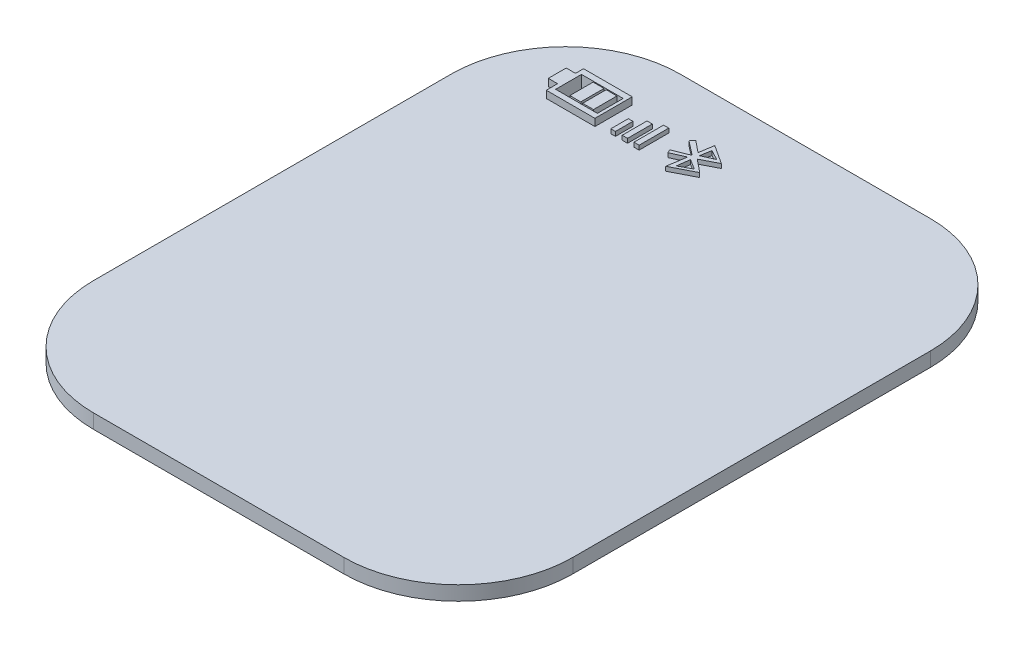
from build123d import *

# Parameters (mm, degrees)
BOSS_EXTRUDE1_DEPTH = 1
SKETCH2_W           = 3.399574798
SKETCH2_H           = 2.604207363
SKETCH2_W_2         = 0.648007004
SKETCH2_H_2         = 1.252018983
BOSS_EXTRUDE2_DEPTH = 0.5
SKETCH3_W           = 2.913906285
SKETCH3_H           = 1.803051724
CUT_EXTRUDE1_DEPTH  = 1
SKETCH4_W           = 0.755256807
SKETCH4_H           = 1.639917717
SKETCH4_W_2         = 0.763724631
SKETCH4_H_2         = 1.626197377
BOSS_EXTRUDE3_DEPTH = 1
SKETCH6_W           = 0.323055787
SKETCH6_H           = 1.224923668
SKETCH6_W_2         = 0.371772392
SKETCH6_H_2         = 1.735099538
SKETCH6_W_3         = 0.361493721
SKETCH6_H_3         = 2.070814397
BOSS_EXTRUDE4_DEPTH = 0.3
BOSS_EXTRUDE8_DEPTH = 0.3


with BuildPart() as part:
    # Sketch1 → Boss-Extrude1 (new body)
    with BuildSketch(Plane(origin=(0, 0, 0), x_dir=(1, 0, 0), z_dir=(0, 1, 0))):
        with BuildLine():
            Line((-8.75, 20.5), (8.75, 20.5))
            ThreePointArc((8.75, 20.5), (14.406854249, 18.156854249), (16.75, 12.5))
            Line((16.75, 12.5), (16.75, -12.5))
            ThreePointArc((16.75, -12.5), (14.406854249, -18.156854249), (8.75, -20.5))
            Line((8.75, -20.5), (-8.75, -20.5))
            ThreePointArc((-8.75, -20.5), (-14.406854249, -18.156854249), (-16.75, -12.5))
            Line((-16.75, -12.5), (-16.75, 12.5))
            ThreePointArc((-16.75, 12.5), (-14.406854249, 18.156854249), (-8.75, 20.5))
        make_face()
    extrude(amount=BOSS_EXTRUDE1_DEPTH)

    # Sketch2 → Boss-Extrude2 (add)
    with BuildSketch(Plane(origin=(0, 1, 0), x_dir=(1, 0, 0), z_dir=(0, 1, 0))):
        with Locations((-10.250837729, 15.647459094)):
            Rectangle(SKETCH2_W, SKETCH2_H)
        with Locations((-12.27462863, 15.762007905)):
            Rectangle(SKETCH2_W_2, SKETCH2_H_2)
    extrude(amount=BOSS_EXTRUDE2_DEPTH)

    # Sketch3 → Cut-Extrude1 (cut)
    with BuildSketch(Plane(origin=(0, 1.5, 0), x_dir=(1, 0, 0), z_dir=(0, 1, 0))):
        with Locations((-10.221842574, 15.632123632)):
            Rectangle(SKETCH3_W, SKETCH3_H)
    extrude(amount=-CUT_EXTRUDE1_DEPTH, mode=Mode.SUBTRACT)

    # Sketch4 → Boss-Extrude3 (add)
    with BuildSketch(Plane(origin=(0, 0.5, 0), x_dir=(1, 0, 0), z_dir=(0, 1, 0))):
        with Locations((-9.510068413, 15.646512941)):
            Rectangle(SKETCH4_W, SKETCH4_H)
        with Locations((-10.421480669, 15.658650775)):
            Rectangle(SKETCH4_W_2, SKETCH4_H_2)
    extrude(amount=BOSS_EXTRUDE3_DEPTH)

    # Sketch6 → Boss-Extrude4 (add)
    with BuildSketch(Plane(origin=(0, 1, 0), x_dir=(1, 0, 0), z_dir=(0, 1, 0))):
        with Locations((-7.401507334, 15.079514795)):
            Rectangle(SKETCH6_W, SKETCH6_H)
        with Locations((-6.585633976, 15.340608205)):
            Rectangle(SKETCH6_W_2, SKETCH6_H_2)
        with Locations((-5.759844772, 15.498462338)):
            Rectangle(SKETCH6_W_3, SKETCH6_H_3)
    extrude(amount=BOSS_EXTRUDE4_DEPTH)

    # Sketch7 → Boss-Extrude8 (add)
    with BuildSketch(Plane(origin=(0, 1, 0), x_dir=(1, 0, 0), z_dir=(0, 1, 0))):
        Polygon((-2.913348429, 17.083305865), (-3.070822573, 16.069437014), (-3.890044364, 16.734757778), (-4.10463288, 16.470530961), (-3.125803438, 15.71545264), (-3.128811108, 15.696088298), (-4.220670364, 15.251854963), (-4.125911477, 15.018951756), (-3.168901436, 15.437973959), (-3.374102624, 14.116823145), (-1.801517614, 14.921145153), (-2.70763201, 15.653067043), (-1.594376902, 16.222457937), align=None)
        Polygon((-2.913348429, 15.389877589), (-3.025116607, 14.50250057), (-2.208716049, 14.94618908), align=None, mode=Mode.SUBTRACT)
        Polygon((-2.834687196, 15.935171595), (-2.70763201, 16.678238629), (-1.993867712, 16.306705112), align=None, mode=Mode.SUBTRACT)
    extrude(amount=BOSS_EXTRUDE8_DEPTH)


solid = part.part
